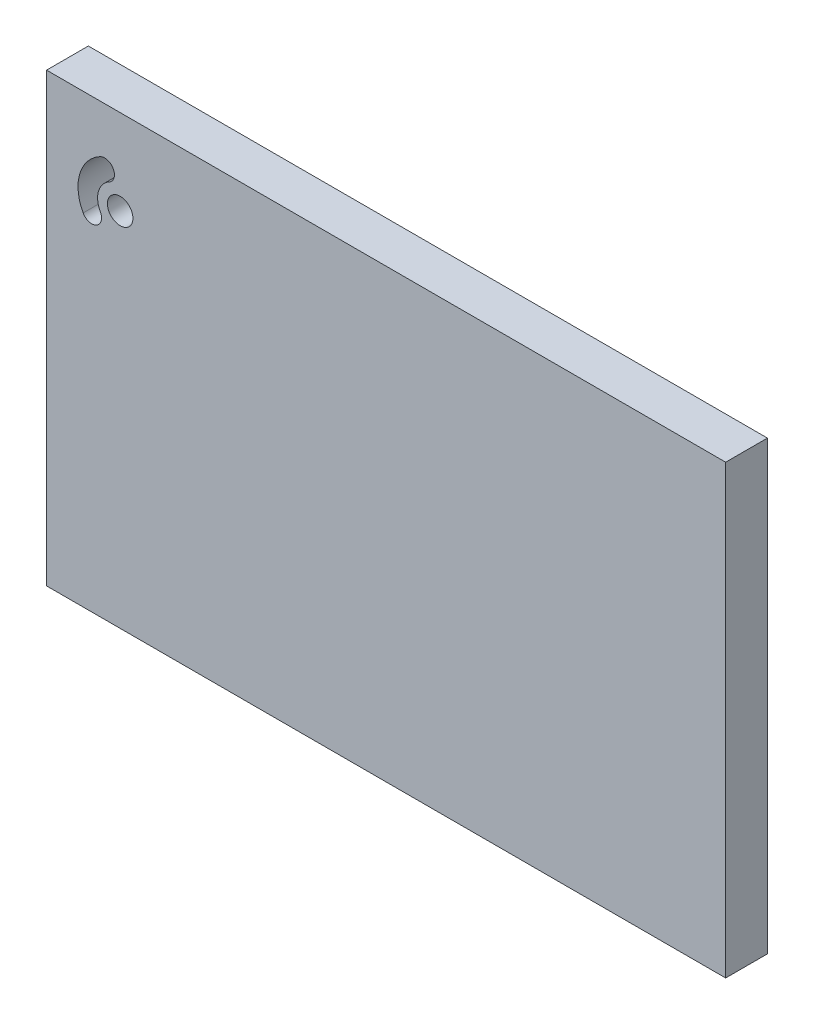
from build123d import *

# Parameters (mm, degrees)
F_1_FR_W        = 162.591921451
F_1_FR_H        = 106.952100423
F_1_FR_R        = 3.052899236
EXTRUDE_1_DEPTH = 10


with BuildPart() as part:
    # Эскиз1_fr → Бобышка-Вытянуть1 (new body)
    with BuildSketch(Plane.XY):
        with Locations((41.575310714, -4.636651753)):
            Rectangle(F_1_FR_W, F_1_FR_H)
        with Locations((-22.101373353, 28.438130748)):
            Circle(F_1_FR_R, mode=Mode.SUBTRACT)
        with BuildLine():
            ThreePointArc((-26.934111294, 37.298150306), (-31.783615034, 31.28584889), (-30.961392911, 23.605392807))
            ThreePointArc((-30.961392911, 23.605392807), (-27.778379385, 22.669212359), (-26.842198936, 25.852225885))
            ThreePointArc((-26.842198936, 25.852225885), (-27.282154135, 29.961889802), (-24.687278216, 33.178956331))
            ThreePointArc((-24.687278216, 33.178956331), (-23.751097767, 36.361969857), (-26.934111294, 37.298150306))
        make_face(mode=Mode.SUBTRACT)
    extrude(amount=EXTRUDE_1_DEPTH)


solid = part.part
